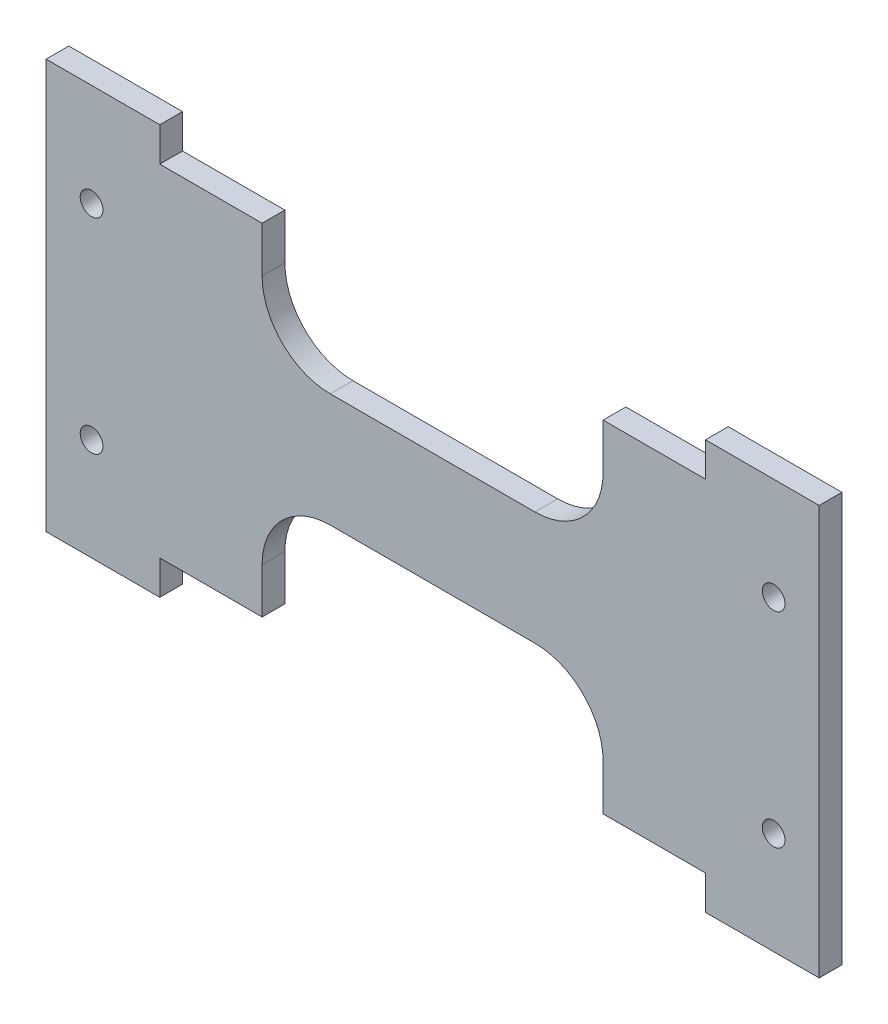
from build123d import *

# Parameters (mm, degrees)
MODEL_R         = 1
EXTRUDE_1_DEPTH = 2


with BuildPart() as part:
    # Model → Бобышка-Вытянуть1 (new body)
    with BuildSketch(Plane.XY):
        with BuildLine():
            Line((15, 20), (24, 20))
            Line((24, 20), (24, 23))
            Line((24, 23), (34, 23))
            Line((34, 23), (34, -13))
            Line((34, -13), (24, -13))
            Line((24, -13), (24, -10))
            Line((24, -10), (15, -10))
            Line((15, -10), (15, -6))
            ThreePointArc((15, -6), (13.242640687, -1.757359313), (9, 0))
            Line((9, 0), (-9, 0))
            ThreePointArc((-9, 0), (-13.242640687, -1.757359313), (-15, -6))
            Line((-15, -6), (-15, -10))
            Line((-15, -10), (-24, -10))
            Line((-24, -10), (-24, -13))
            Line((-24, -13), (-34, -13))
            Line((-34, -13), (-34, 23))
            Line((-34, 23), (-24, 23))
            Line((-24, 23), (-24, 20))
            Line((-24, 20), (-15, 20))
            Line((-15, 20), (-15, 16))
            ThreePointArc((-15, 16), (-13.242640687, 11.757359313), (-9, 10))
            Line((-9, 10), (9, 10))
            ThreePointArc((9, 10), (13.242640687, 11.757359313), (15, 16))
            Line((15, 16), (15, 20))
        make_face()
        with Locations((30, -4)):
            Circle(MODEL_R, mode=Mode.SUBTRACT)
        with Locations((30, 14)):
            Circle(MODEL_R, mode=Mode.SUBTRACT)
        with Locations((-30, 14)):
            Circle(MODEL_R, mode=Mode.SUBTRACT)
        with Locations((-30, -4)):
            Circle(MODEL_R, mode=Mode.SUBTRACT)
    extrude(amount=EXTRUDE_1_DEPTH)


solid = part.part
